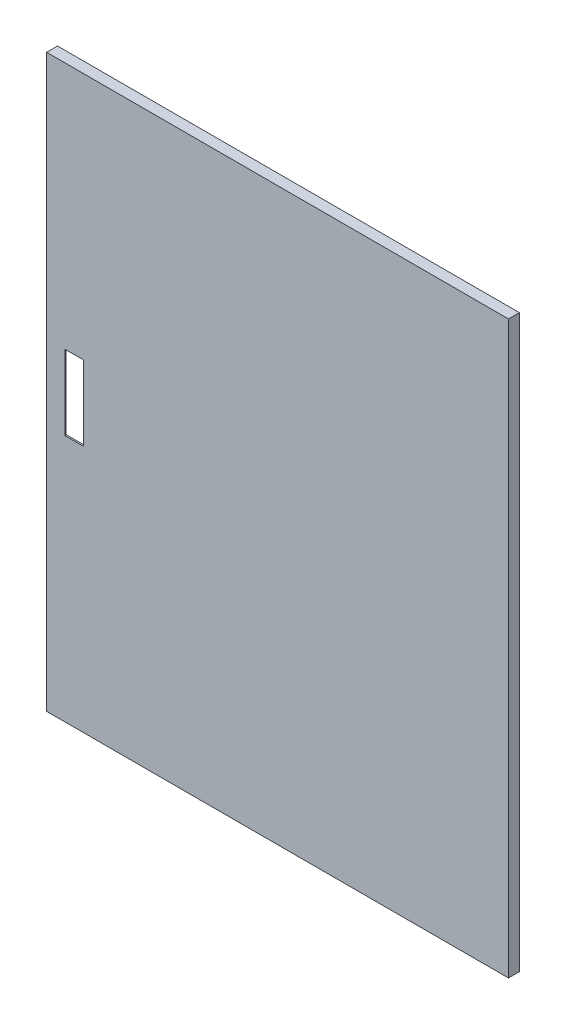
from build123d import *

# Parameters (mm, degrees)
SKETCH_1_W          = 636
SKETCH_1_H          = 786
EXTRUDE_1_DEPTH     = 2
SKETCH_2_W          = 636
SKETCH_2_H          = 786
SKETCH_2_W_2        = 632
SKETCH_2_H_2        = 782
EXTRUDE_2_DEPTH     = 11
SKETCH_3_W          = 636
SKETCH_3_H          = 786
SKETCH_3_W_2        = 616
SKETCH_3_H_2        = 766
EXTRUDE_3_DEPTH     = 2
SKETCH_4_W          = 26
SKETCH_4_H          = 103
CUT_EXTRUDE_1_DEPTH = 10


with BuildPart() as part:
    # 草图1 → 凸台-拉伸1 (new body)
    with BuildSketch(Plane.XY):
        Rectangle(SKETCH_1_W, SKETCH_1_H)
    extrude(amount=EXTRUDE_1_DEPTH)

    # 草图2 → 凸台-拉伸2 (add)
    with BuildSketch(Plane(origin=(0, 0, 0), x_dir=(-1, 0, 0), z_dir=(0, 0, -1))):
        Rectangle(SKETCH_2_W, SKETCH_2_H)
        Rectangle(SKETCH_2_W_2, SKETCH_2_H_2, mode=Mode.SUBTRACT)
    extrude(amount=EXTRUDE_2_DEPTH)

    # 草图3 → 凸台-拉伸3 (add)
    with BuildSketch(Plane(origin=(0, 0, -11), x_dir=(-1, 0, 0), z_dir=(0, 0, -1))):
        Rectangle(SKETCH_3_W, SKETCH_3_H)
        Rectangle(SKETCH_3_W_2, SKETCH_3_H_2, mode=Mode.SUBTRACT)
    extrude(amount=EXTRUDE_3_DEPTH)

    # 草图4 → 切除-拉伸1 (cut)
    with BuildSketch(Plane.XY.offset(2)):
        with Locations((-280, 0)):
            Rectangle(SKETCH_4_W, SKETCH_4_H)
    extrude(amount=-CUT_EXTRUDE_1_DEPTH, mode=Mode.SUBTRACT)


solid = part.part
